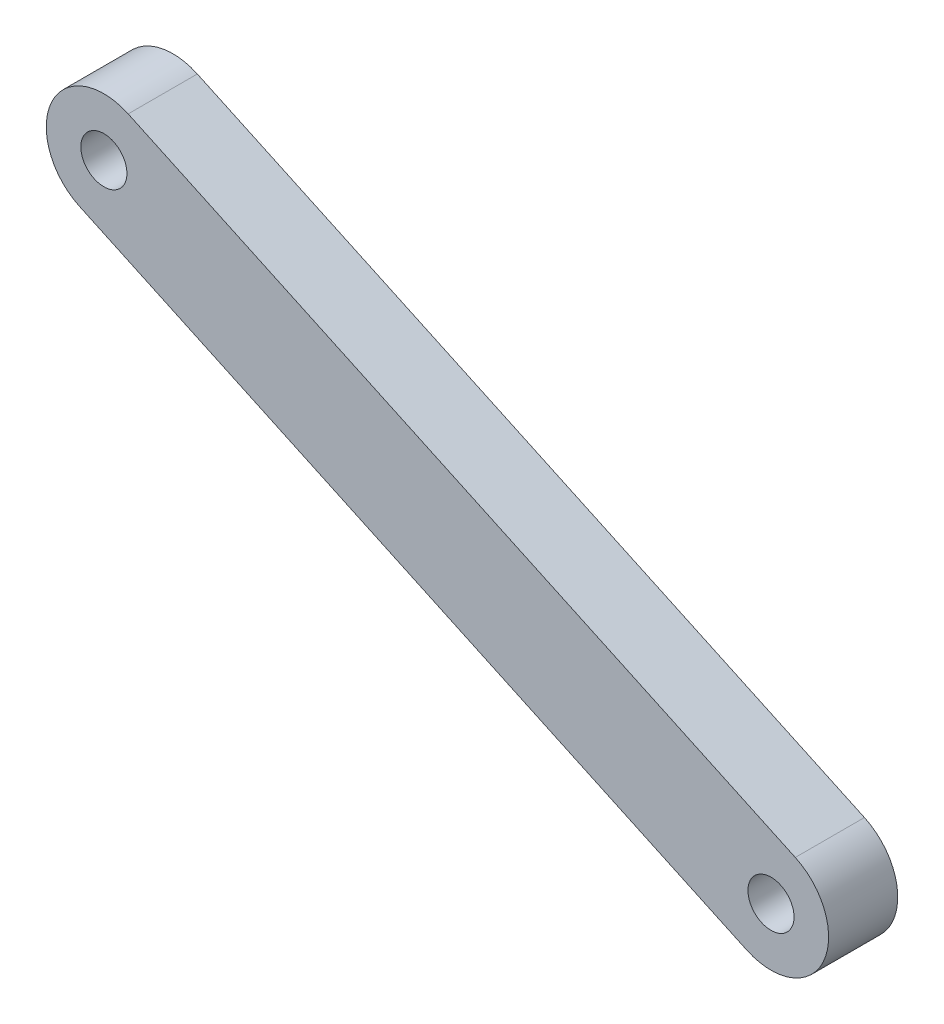
from build123d import *

# Parameters (mm, degrees)
SKETCH1_R           = 1
BOSS_EXTRUDE1_DEPTH = 3


with BuildPart() as part:
    # Sketch1 → Boss-Extrude1 (new body)
    with BuildSketch(Plane.XY):
        with BuildLine():
            Line((-19.600992406, 58.446570176), (9.348909366, 44.978060399))
            ThreePointArc((9.348909366, 44.978060399), (10.56106091, 41.656812345), (7.239812856, 40.444660802))
            Line((7.239812856, 40.444660802), (-21.710088916, 53.913170579))
            ThreePointArc((-21.710088916, 53.913170579), (-22.92224046, 57.234418633), (-19.600992406, 58.446570176))
        make_face()
        with Locations((-20.655540661, 56.179870378)):
            Circle(SKETCH1_R, mode=Mode.SUBTRACT)
        with Locations((8.294361111, 42.7113606)):
            Circle(SKETCH1_R, mode=Mode.SUBTRACT)
    extrude(amount=BOSS_EXTRUDE1_DEPTH)


solid = part.part
